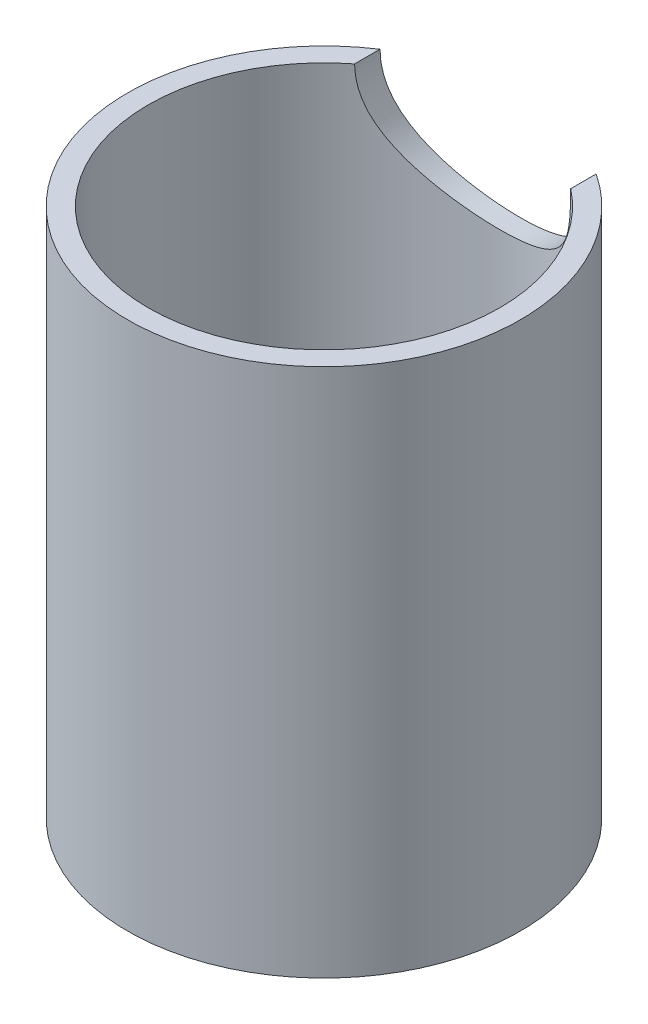
from build123d import *

# Parameters (mm, degrees)
SKETCH1_R           = 19
SKETCH1_R_2         = 17
BOSS_EXTRUDE1_DEPTH = 51.2
SKETCH2_R           = 10.45
CUT_EXTRUDE1_DEPTH  = 58.822486975


with BuildPart() as part:
    # Sketch1 → Boss-Extrude1 (new body)
    with BuildSketch(Plane(origin=(0, 0, 0), x_dir=(1, 0, 0), z_dir=(0, 1, 0))):
        with Locations(Location((0, 0, 0), (0, 0, 270))):
            Circle(SKETCH1_R)
        with Locations(Location((0, 0, 0), (0, 0, 270))):
            Circle(SKETCH1_R_2, mode=Mode.SUBTRACT)
    extrude(amount=BOSS_EXTRUDE1_DEPTH)

    # Sketch2 → Cut-Extrude1 (cut, through all)
    with BuildSketch(Plane.XY):
        with Locations((0, 51.2)):
            Circle(SKETCH2_R)
        Circle(SKETCH2_R)
    extrude(amount=-CUT_EXTRUDE1_DEPTH, mode=Mode.SUBTRACT)


solid = part.part
